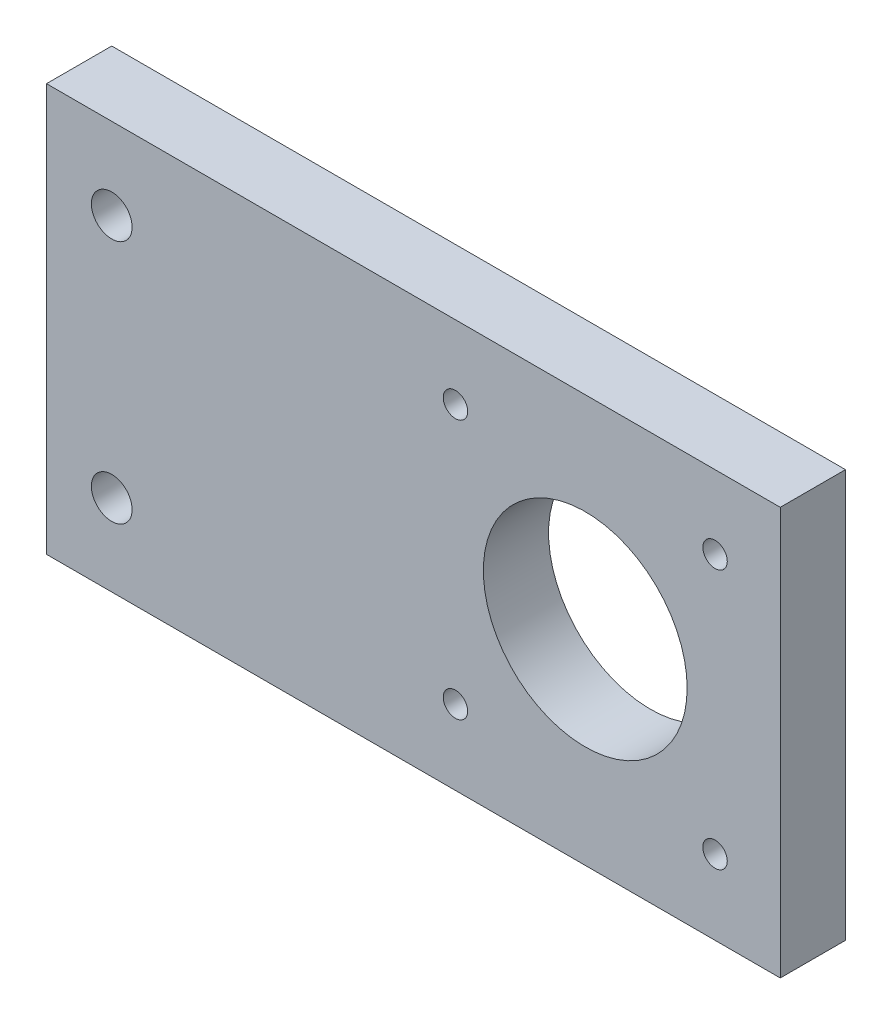
from build123d import *

# Parameters (mm, degrees)
SKETCH1_W           = 90
SKETCH1_H           = 50
BOSS_EXTRUDE1_DEPTH = 8
SKETCH2_R           = 12.5
SKETCH2_R_2         = 1.5
SKETCH2_R_3         = 2.5
CUT_EXTRUDE1_DEPTH  = 8


with BuildPart() as part:
    # Sketch1 → Boss-Extrude1 (new body)
    with BuildSketch(Plane.XY):
        Rectangle(SKETCH1_W, SKETCH1_H)
    extrude(amount=BOSS_EXTRUDE1_DEPTH)

    # Sketch2 → Cut-Extrude1 (cut)
    with BuildSketch(Plane.XY.offset(8)):
        with Locations((21.08, 0.08)):
            Circle(SKETCH2_R)
        with Locations((37, -15.84)):
            Circle(SKETCH2_R_2)
        with Locations((-37, -15)):
            Circle(SKETCH2_R_3)
        with Locations((5.16, -15.84)):
            Circle(SKETCH2_R_2)
        with Locations((37, 16)):
            Circle(SKETCH2_R_2)
        with Locations((5.16, 16)):
            Circle(SKETCH2_R_2)
        with Locations((-37, 15)):
            Circle(SKETCH2_R_3)
    extrude(amount=-CUT_EXTRUDE1_DEPTH, mode=Mode.SUBTRACT)


solid = part.part
